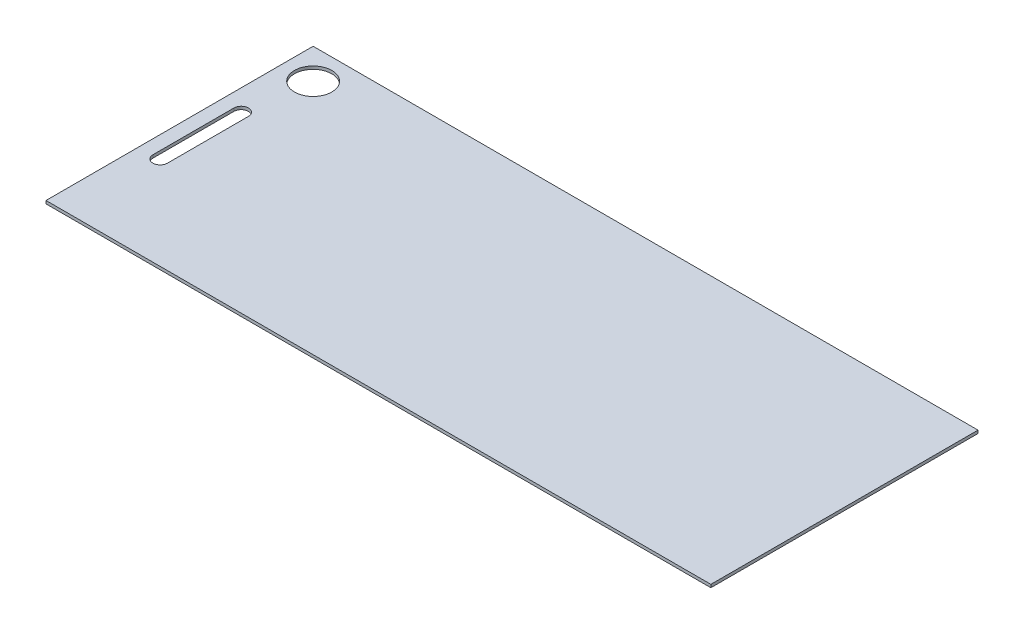
from build123d import *

# Parameters (mm, degrees)
SKETCH1_W           = 1706.88
SKETCH1_H           = 685.8
BOSS_EXTRUDE1_DEPTH = 7.62
SKETCH2_R           = 48.003123946
CUT_EXTRUDE1_DEPTH  = 7.62


with BuildPart() as part:
    # Sketch1 → Boss-Extrude1 (new body)
    with BuildSketch(Plane(origin=(0, 0, 0), x_dir=(1, 0, 0), z_dir=(0, 1, 0))):
        Rectangle(SKETCH1_W, SKETCH1_H)
    extrude(amount=BOSS_EXTRUDE1_DEPTH)

    # Sketch2 → Cut-Extrude1 (cut)
    with BuildSketch(Plane(origin=(0, 7.62, 0), x_dir=(1, 0, 0), z_dir=(0, 1, 0))):
        with Locations(Location((-775.698925032, 265.158925032, 0), (0, 0, 270))):
            Circle(SKETCH2_R)
        with BuildLine():
            Line((-780.493781084, 103.980830335), (-780.493781084, -103.980830335))
            ThreePointArc((-780.493781084, -103.980830335), (-799.17629755, -122.663346801), (-817.858814016, -103.980830335))
            Line((-817.858814016, -103.980830335), (-817.858814016, 103.980830335))
            ThreePointArc((-817.858814016, 103.980830335), (-799.17629755, 122.663346801), (-780.493781084, 103.980830335))
        make_face()
    extrude(amount=-CUT_EXTRUDE1_DEPTH, mode=Mode.SUBTRACT)


solid = part.part
